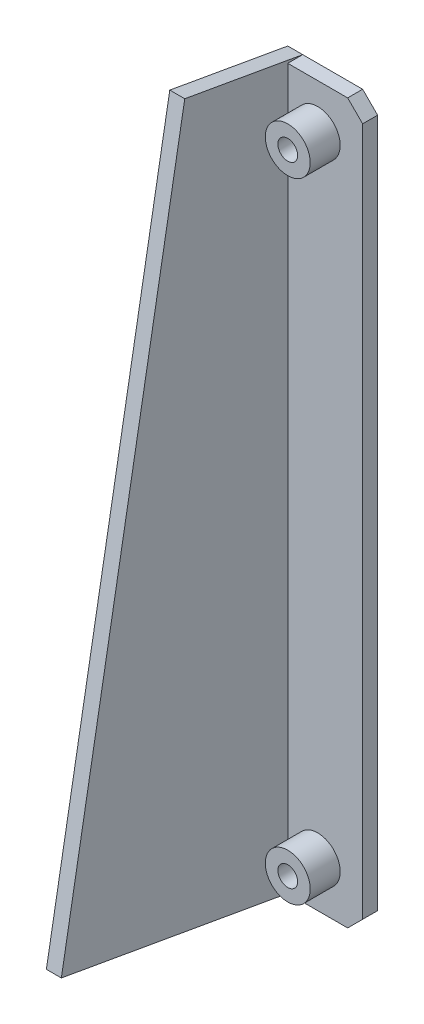
from build123d import *

# Parameters (mm, degrees)
SKETCH1_W                       = 9.525
SKETCH1_H                       = 76.2
BOSS_EXTRUDE1_DEPTH             = 1.5875
CHAMFER2_SIZE                   = 1.5875
F_97_0_0825_DIAMETER_HOLE1_D    = 2.0955
SKETCH5_R                       = 2.38125
SKETCH5_R_2                     = 1.04775
BOSS_EXTRUDE2_DEPTH             = 3.175
BOSS_EXTRUDE4_REACH             = 77.644
SKETCH7_W                       = 1.5875
SKETCH7_H                       = 75.318017262
BOSS_EXTRUDE4_DIRECTION_2_DEPTH = 12.7
BOSS_EXTRUDE5_REACH             = 79.8


with BuildPart() as part:
    # Sketch1 → Boss-Extrude1 (new body)
    with BuildSketch(Plane.XY):
        with Locations((-4.7625, 38.1)):
            Rectangle(SKETCH1_W, SKETCH1_H)
    extrude(amount=BOSS_EXTRUDE1_DEPTH)

    # Chamfer2
    chamfer2_edges = [part.edges().sort_by_distance(p)[0] for p in [
        (0, 76.2, 0.79375),
        (-9.525, 76.2, 0.79375),
        (0, 0, 0.79375),
        (-9.525, 0, 0.79375),
    ]]
    chamfer(chamfer2_edges, length=CHAMFER2_SIZE)

    # #97 (0.0825) Diameter Hole1 (through all)
    with Locations(Plane.XY.offset(1.5875)):
        with Locations((-4.7625, 4.7625), (-4.7625, 71.4375)):
            Hole(F_97_0_0825_DIAMETER_HOLE1_D / 2)

    # Sketch5 → Boss-Extrude2 (add)
    # profile 1 of 2: a face of its own
    with BuildSketch(Plane.XY.offset(1.5875)):
        with Locations((-4.7625, 4.7625)):
            Circle(SKETCH5_R)
        with Locations((-4.7625, 4.7625)):
            Circle(SKETCH5_R_2, mode=Mode.SUBTRACT)
    # profile 2 of 2: a face of its own
    with BuildSketch(Plane.XY.offset(1.5875)):
        with Locations((-4.7625, 71.4375)):
            Circle(SKETCH5_R)
        with Locations((-4.7625, 71.4375)):
            Circle(SKETCH5_R_2, mode=Mode.SUBTRACT)
    extrude(amount=BOSS_EXTRUDE2_DEPTH)

    # Boss-Extrude4: up to this face of the body (flat: up to its plane)
    boss_extrude4_end = Plane(part.part.faces().sort_by_distance((-4.7625, 38.1, 1.5875))[0])
    # Sketch7 → Boss-Extrude4 (add, up to the picked face)
    with BuildSketch(Plane(origin=(0, 2.297711148, 13.030967461), x_dir=(-1, 0, 0), z_dir=(0, -0.1736481776669307, -0.984807753012208)), mode=Mode.PRIVATE) as boss_extrude4_sk1:
        with Locations((8.73125, 37.383342149)):
            Rectangle(SKETCH7_W, SKETCH7_H)
    boss_extrude4_tool1 = split(extrude(boss_extrude4_sk1.sketch, amount=BOSS_EXTRUDE4_REACH, mode=Mode.PRIVATE), bisect_by=boss_extrude4_end, keep=Keep.BOTH, mode=Mode.PRIVATE)
    add(boss_extrude4_tool1.solids().sort_by(Axis((-8.73125, 39.113116, 6.539418), (0, -0.1736481776669307, -0.984807753012208)))[0])

    # Sketch7 → Boss-Extrude4 direction 2 (add)
    with BuildSketch(Plane(origin=(0, 2.297711148, 13.030967461), x_dir=(-1, 0, 0), z_dir=(0, -0.1736481776669307, -0.984807753012208))):
        with Locations((8.73125, 37.383342149)):
            Rectangle(SKETCH7_W, SKETCH7_H)
    extrude(amount=-BOSS_EXTRUDE4_DIRECTION_2_DEPTH)

    # Boss-Extrude5: up to this face of the body (flat: up to its plane)
    boss_extrude5_end = Plane(part.part.faces().sort_by_distance((-4.7625, 38.1, 0))[0])
    # Sketch8 → Boss-Extrude5 (add, up to the picked face)
    with BuildSketch(Plane(origin=(0, 2.297711148, 13.030967461), x_dir=(-1, 0, 0), z_dir=(0, -0.17364817766693066, -0.9848077530122081)), mode=Mode.PRIVATE) as boss_extrude5_sk1:
        Polygon((9.525, 74.993743341), (9.525, 75.04235078), (7.9375, 75.04235078), align=None)
    boss_extrude5_tool1 = split(extrude(boss_extrude5_sk1.sketch, amount=BOSS_EXTRUDE5_REACH, mode=Mode.PRIVATE), bisect_by=boss_extrude5_end, keep=Keep.BOTH, mode=Mode.PRIVATE)
    add(boss_extrude5_tool1.solids().sort_by(Axis((-8.995833, 76.184044, 0.002814), (0, -0.17364817766693066, -0.9848077530122081)))[0])


solid = part.part
